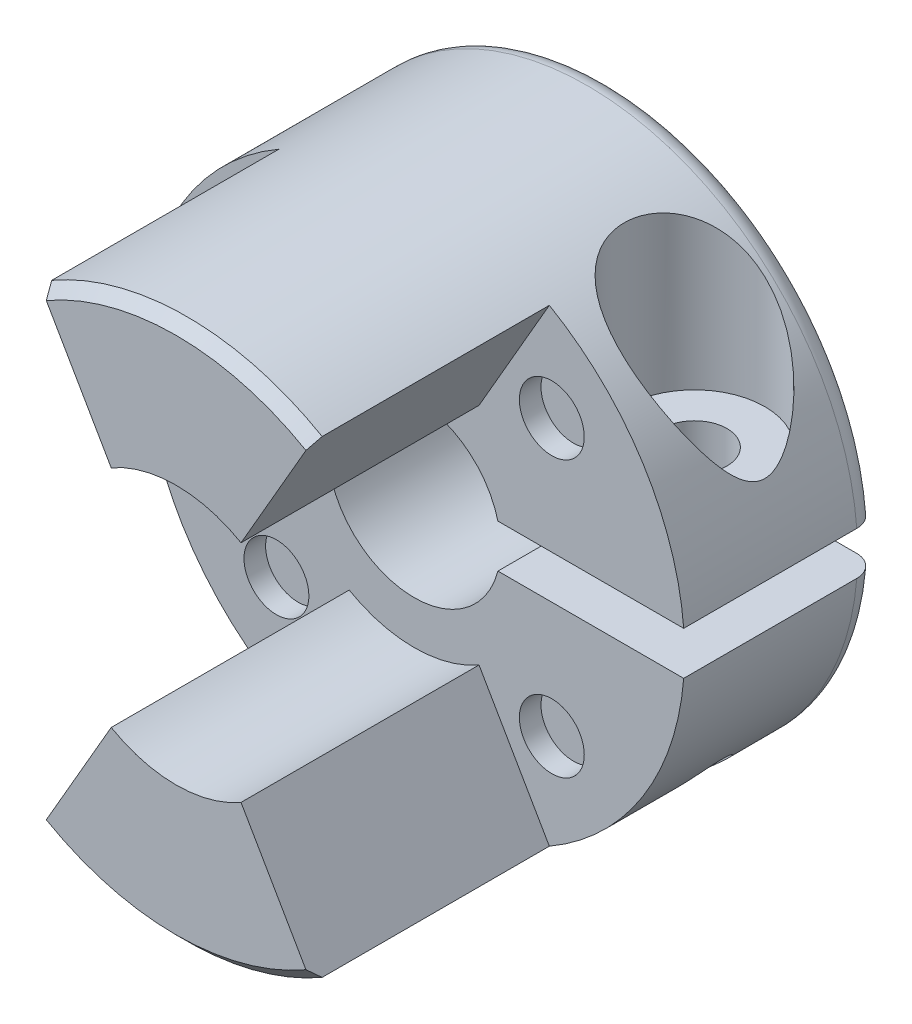
from build123d import *

# Parameters (mm, degrees)
ESBO_O1_R                 = 12.5
RESSALTO_EXTRUS_O1_DEPTH  = 20
CORTE_EXTRUS_O3_START     = -11
CORTE_EXTRUS_O3_DEPTH     = 11
ESBO_O3_R                 = 4
CORTE_EXTRUS_O4_DEPTH     = 27.69269563
ESBO_O6_W                 = 12
ESBO_O6_H                 = 2
CORTE_EXTRUS_O5_DEPTH     = 21.820662814
CORTE_EXTRUS_O6_START     = -3
ESBO_O7_R                 = 3.25
CORTE_EXTRUS_O6_DEPTH     = 25.175356483
FURO_ROSCADO_DE_M3X0_51_D = 2.5
FILETE1_R                 = 1
ESBO_O10_R                = 1.5
CORTE_EXTRUS_O7_DEPTH     = 1
CHANFRO1_SIZE             = 0.5
CORTE_EXTRUS_O8_REACH     = 30.784
ESBO_O11_R                = 1.5
ESBO_O12_R                = 6
CORTE_EXTRUS_O9_DEPTH     = 11
PADR_OCIRCULAR1_COUNT     = 4
CHANFRO2_SIZE             = 0.5


with BuildPart() as part:
    # Esboço1 → Ressalto-extrusão1 (new body)
    with BuildSketch(Plane.XY):
        Circle(ESBO_O1_R)
    extrude(amount=RESSALTO_EXTRUS_O1_DEPTH)

    # Esboço2 → Corte-extrusão3 (cut)
    with BuildSketch(Plane.XY.offset(20).offset(CORTE_EXTRUS_O3_START)):
        with BuildLine():
            Line((0, 0), (6.25, 10.825317547))
            ThreePointArc((6.25, 10.825317547), (12.5, 0), (6.25, -10.825317547))
            Line((6.25, -10.825317547), (0, 0))
        make_face()
    corte_extrus_o3 = extrude(amount=CORTE_EXTRUS_O3_DEPTH, mode=Mode.SUBTRACT)

    # Esboço3 → Corte-extrusão4 (cut, through all)
    with BuildSketch(Plane(origin=(0, 0, 0), x_dir=(-1, 0, 0), z_dir=(0, 0, -1))):
        Circle(ESBO_O3_R)
    extrude(amount=-CORTE_EXTRUS_O4_DEPTH, mode=Mode.SUBTRACT)

    # Espelhar1: Corte-extrusão3 across plane
    add(corte_extrus_o3.mirror(Plane(origin=(0, 0, 0), x_dir=(0, 0, 1), z_dir=(1, 0, 0))), mode=Mode.SUBTRACT)

    # Esboço6 → Corte-extrusão5 (cut, through all)
    with BuildSketch(Plane.XY.offset(9)):
        with Locations((7, 0)):
            Rectangle(ESBO_O6_W, ESBO_O6_H)
    extrude(amount=-CORTE_EXTRUS_O5_DEPTH, mode=Mode.SUBTRACT)

    # Esboço7 → Corte-extrusão6 (cut, through all)
    with BuildSketch(Plane.XZ.offset(-1).offset(CORTE_EXTRUS_O6_START)):
        with Locations(Location((8.459935794, 4.5, 0), (0, 0, 270))):
            Circle(ESBO_O7_R)
    extrude(amount=-CORTE_EXTRUS_O6_DEPTH, mode=Mode.SUBTRACT)

    # Furo roscado de M3x0.51 (through all)
    with Locations(Plane(origin=(0, 4, 0), x_dir=(1, 0, 0), z_dir=(0, 1, 0))):
        with Locations((8.459935794, -4.5)):
            Hole(FURO_ROSCADO_DE_M3X0_51_D / 2)

    # Filete1
    filete1_edges = [part.edges().sort_by_distance(p)[0] for p in [
        (-12.5, 0, 0),
    ]]
    fillet(filete1_edges, radius=FILETE1_R)

    # Esboço10 → Corte-extrusão7 (cut)
    with BuildSketch(Plane.XY.offset(9)):
        with Locations((6.363961031, -6.363961031)):
            Circle(ESBO_O10_R)
    corte_extrus_o7 = extrude(amount=-CORTE_EXTRUS_O7_DEPTH, mode=Mode.SUBTRACT)

    # Chanfro1
    chanfro1_edges = [part.edges().sort_by_distance(p)[0] for p in [
        (0, -12.5, 20),
        (0, 12.5, 20),
    ]]
    chamfer(chanfro1_edges, length=CHANFRO1_SIZE)

    # Esboço11 → Corte-extrusão8 (cut, up to next)
    with BuildSketch(Plane(origin=(0, 4, 0), x_dir=(1, 0, 0), z_dir=(0, 1, 0)), mode=Mode.PRIVATE) as corte_extrus_o8_sk1:
        with Locations(Location((8.459935794, -4.5, 0), (0, 0, 270))):
            Circle(ESBO_O11_R)
    corte_extrus_o8_tool1 = extrude(corte_extrus_o8_sk1.sketch, amount=-CORTE_EXTRUS_O8_REACH, mode=Mode.PRIVATE) & part.part
    add(corte_extrus_o8_tool1.solids().sort_by_distance((8.459936, 4, 4.5))[0], mode=Mode.SUBTRACT)

    # Esboço12 → Corte-extrusão9 (cut)
    with BuildSketch(Plane.XY.offset(20)):
        Circle(ESBO_O12_R)
    extrude(amount=-CORTE_EXTRUS_O9_DEPTH, mode=Mode.SUBTRACT)

    # PadrãoCircular1: Corte-extrusão7 ×4 about axis
    padr_ocircular1_axis = Axis((0, 0, 0), (0, 0, 1))
    for i in range(1, PADR_OCIRCULAR1_COUNT):
        add(corte_extrus_o7.rotate(padr_ocircular1_axis, i * 360 / PADR_OCIRCULAR1_COUNT), mode=Mode.SUBTRACT)

    # Chanfro2
    chanfro2_edges = [part.edges().sort_by_distance(p)[0] for p in [
        (-4, 0, 0),
    ]]
    chamfer(chanfro2_edges, length=CHANFRO2_SIZE)


solid = part.part
